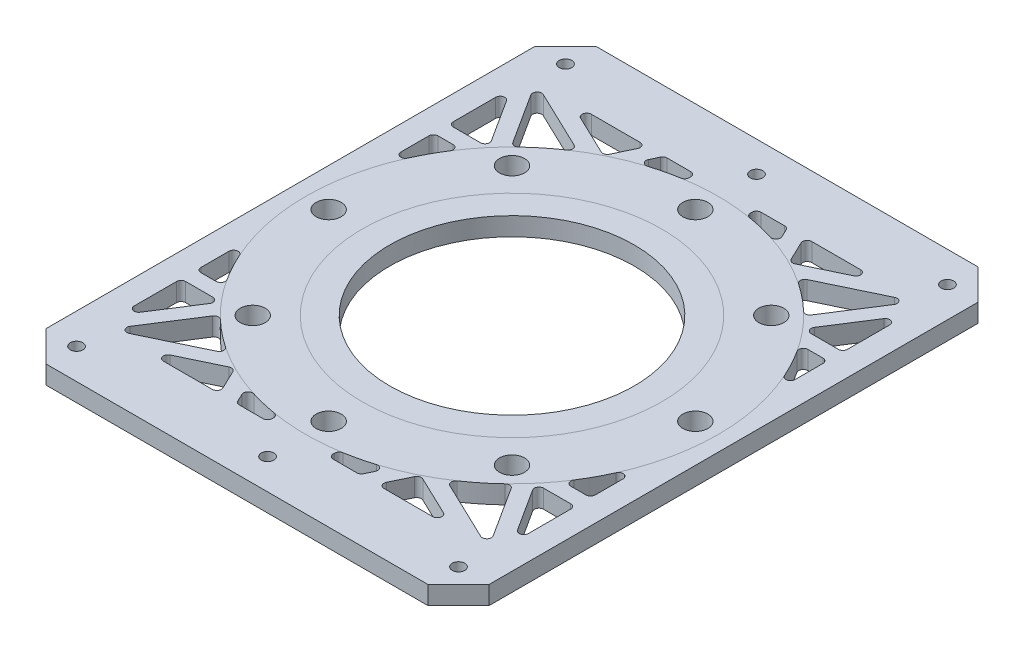
from build123d import *

# Parameters (mm, degrees)
SKETCH_1_W          = 145
SKETCH_1_H          = 180
SKETCH_1_R          = 2.05
EXTRUDE_1_DEPTH     = 6
SKETCH_2_R          = 4.1
CUT_EXTRUDE_1_DEPTH = 6
SKETCH_3_R          = 40
CUT_EXTRUDE_2_DEPTH = 10
FILLET_1_R          = 1.5
CHAMFER_1_SIZE      = 10


with BuildPart() as part:
    # 草图1 → 凸台-拉伸1 (new body)
    with BuildSketch(Plane(origin=(0, 0, 0), x_dir=(1, 0, 0), z_dir=(0, 1, 0))):
        Rectangle(SKETCH_1_W, SKETCH_1_H)
        with Locations(Location((-62.5, 80, 0), (0, 0, 270))):
            Circle(SKETCH_1_R, mode=Mode.SUBTRACT)
        with Locations(Location((0, 80, 0), (0, 0, 270))):
            Circle(SKETCH_1_R, mode=Mode.SUBTRACT)
        with Locations(Location((62.5, 80, 0), (0, 0, 90))):
            Circle(SKETCH_1_R, mode=Mode.SUBTRACT)
        with Locations(Location((62.5, -80, 0), (0, 0, 270))):
            Circle(SKETCH_1_R, mode=Mode.SUBTRACT)
        with Locations(Location((0, -80, 0), (0, 0, 90))):
            Circle(SKETCH_1_R, mode=Mode.SUBTRACT)
        with Locations(Location((-62.5, -80, 0), (0, 0, 90))):
            Circle(SKETCH_1_R, mode=Mode.SUBTRACT)
    extrude(amount=EXTRUDE_1_DEPTH)

    # 草图2 → 切除-拉伸1 (cut)
    with BuildSketch(Plane(origin=(0, 6, 0), x_dir=(1, 0, 0), z_dir=(0, 1, 0))):
        with Locations(Location((0, 60, 0), (0, 0, 270))):
            Circle(SKETCH_2_R)
        with Locations(Location((42.426406871, 42.426406871, 0), (0, 0, 270))):
            Circle(SKETCH_2_R)
        with Locations(Location((60, 0, 0), (0, 0, 270))):
            Circle(SKETCH_2_R)
        with Locations(Location((42.426406871, -42.426406871, 0), (0, 0, 270))):
            Circle(SKETCH_2_R)
        with Locations(Location((0, -60, 0), (0, 0, 270))):
            Circle(SKETCH_2_R)
        with Locations(Location((-42.426406871, -42.426406871, 0), (0, 0, 270))):
            Circle(SKETCH_2_R)
        with Locations(Location((-60, 0, 0), (0, 0, 270))):
            Circle(SKETCH_2_R)
        with Locations(Location((-42.426406871, 42.426406871, 0), (0, 0, 270))):
            Circle(SKETCH_2_R)
    extrude(amount=-CUT_EXTRUDE_1_DEPTH, mode=Mode.SUBTRACT)

    # 草图3 → 切除-拉伸2 (cut)
    with BuildSketch(Plane(origin=(0, 6, 0), x_dir=(1, 0, 0), z_dir=(0, 1, 0))):
        with BuildLine():
            ThreePointArc((-64.5, 19.899748742), (-60.612923678, 29.703930433), (-55.246109243, 38.782952615))
            Line((-55.246109243, 38.782952615), (-64.5, 38.782952615))
            Line((-64.5, 38.782952615), (-64.5, 19.899748742))
        make_face()
        Polygon((-51.374147782, 43.782952615), (-64.5, 64.257396399), (-64.5, 43.782952615), align=None)
        with BuildLine():
            Line((-35.70065504, 57.286239444), (-62.242241097, 70))
            Line((-62.242241097, 70), (-47.872974973, 47.586009155))
            ThreePointArc((-47.872974973, 47.586009155), (-42.067345118, 52.788147104), (-35.70065504, 57.286239444))
        make_face()
        Polygon((-30.375213045, 60.279320106), (-25.718882547, 70), (-50.668363981, 70), align=None)
        with BuildLine():
            Line((-10, 66.755149614), (-10, 70))
            Line((-10, 70), (-20.174846783, 70))
            Line((-20.174846783, 70), (-23.372570135, 63.324347334))
            ThreePointArc((-23.372570135, 63.324347334), (-16.774227566, 65.382530462), (-10, 66.755149614))
        make_face()
        with BuildLine():
            Line((10, 70), (10, 66.755149614))
            ThreePointArc((10, 66.755149614), (16.774227566, 65.382530462), (23.372570135, 63.324347334))
            Line((23.372570135, 63.324347334), (20.174846783, 70))
            Line((20.174846783, 70), (10, 70))
        make_face()
        Polygon((25.718882547, 70), (30.375213045, 60.279320106), (50.668363981, 70), align=None)
        with BuildLine():
            Line((62.242241097, 70), (35.70065504, 57.286239444))
            ThreePointArc((35.70065504, 57.286239444), (42.067345118, 52.788147104), (47.872974973, 47.586009155))
            Line((47.872974973, 47.586009155), (62.242241097, 70))
        make_face()
        Polygon((64.5, 64.257396399), (51.374147782, 43.782952615), (64.5, 43.782952615), align=None)
        with BuildLine():
            Line((64.5, 38.782952615), (55.246109243, 38.782952615))
            ThreePointArc((55.246109243, 38.782952615), (60.612923678, 29.703930433), (64.5, 19.899748742))
            Line((64.5, 19.899748742), (64.5, 38.782952615))
        make_face()
        with BuildLine():
            Line((64.5, -38.782952615), (64.5, -19.899748742))
            ThreePointArc((64.5, -19.899748742), (60.612923678, -29.703930433), (55.246109243, -38.782952615))
            Line((55.246109243, -38.782952615), (64.5, -38.782952615))
        make_face()
        Polygon((64.5, -64.257396399), (64.5, -43.782952615), (51.374147782, -43.782952615), align=None)
        with BuildLine():
            Line((62.242241097, -70), (47.872974973, -47.586009155))
            ThreePointArc((47.872974973, -47.586009155), (42.067345118, -52.788147104), (35.70065504, -57.286239444))
            Line((35.70065504, -57.286239444), (62.242241097, -70))
        make_face()
        Polygon((25.718882547, -70), (50.668363981, -70), (30.375213045, -60.279320106), align=None)
        with BuildLine():
            ThreePointArc((23.372570135, -63.324347334), (16.774227566, -65.382530462), (10, -66.755149614))
            Line((10, -66.755149614), (10, -70))
            Line((10, -70), (20.174846783, -70))
            Line((20.174846783, -70), (23.372570135, -63.324347334))
        make_face()
        with BuildLine():
            ThreePointArc((-10, -66.755149614), (-16.774227566, -65.382530462), (-23.372570135, -63.324347334))
            Line((-23.372570135, -63.324347334), (-20.174846783, -70))
            Line((-20.174846783, -70), (-10, -70))
            Line((-10, -70), (-10, -66.755149614))
        make_face()
        Polygon((-30.375213045, -60.279320106), (-50.668363981, -70), (-25.718882547, -70), align=None)
        with BuildLine():
            ThreePointArc((-35.70065504, -57.286239444), (-42.067345118, -52.788147104), (-47.872974973, -47.586009155))
            Line((-47.872974973, -47.586009155), (-62.242241097, -70))
            Line((-62.242241097, -70), (-35.70065504, -57.286239444))
        make_face()
        Polygon((-51.374147782, -43.782952615), (-64.5, -43.782952615), (-64.5, -64.257396399), align=None)
        with BuildLine():
            ThreePointArc((-55.246109243, -38.782952615), (-60.612923678, -29.703930433), (-64.5, -19.899748742))
            Line((-64.5, -19.899748742), (-64.5, -38.782952615))
            Line((-64.5, -38.782952615), (-55.246109243, -38.782952615))
        make_face()
        with Locations(Location((0, 0, 0), (0, 0, 270))):
            Circle(SKETCH_3_R)
    extrude(amount=-CUT_EXTRUDE_2_DEPTH, mode=Mode.SUBTRACT)

    # 圆角1
    fillet_1_edges = [part.edges().sort_by_distance(p)[0] for p in [
        (-10, 3, -66.755149614),
        (-23.372570135, 3, -63.324347334),
        (-20.174846783, 3, -70),
        (-10, 3, -70),
        (-30.375213045, 3, -60.279320106),
        (-50.668363981, 3, -70),
        (-25.718882547, 3, -70),
        (-51.374147782, 3, -43.782952615),
        (-64.5, 3, -43.782952615),
        (-64.5, 3, -64.257396399),
        (-35.70065504, 3, -57.286239444),
        (-47.872974973, 3, -47.586009155),
        (-62.242241097, 3, -70),
        (47.872974973, 3, -47.586009155),
        (35.70065504, 3, -57.286239444),
        (62.242241097, 3, -70),
        (51.374147782, 3, -43.782952615),
        (64.5, 3, -64.257396399),
        (64.5, 3, -43.782952615),
        (50.668363981, 3, -70),
        (30.375213045, 3, -60.279320106),
        (25.718882547, 3, -70),
        (23.372570135, 3, -63.324347334),
        (10, 3, -66.755149614),
        (10, 3, -70),
        (20.174846783, 3, -70),
        (-50.668363981, 3, 70),
        (-30.375213045, 3, 60.279320106),
        (-25.718882547, 3, 70),
        (-23.372570135, 3, 63.324347334),
        (-10, 3, 66.755149614),
        (-10, 3, 70),
        (-20.174846783, 3, 70),
        (10, 3, 66.755149614),
        (23.372570135, 3, 63.324347334),
        (20.174846783, 3, 70),
        (10, 3, 70),
        (30.375213045, 3, 60.279320106),
        (50.668363981, 3, 70),
        (25.718882547, 3, 70),
        (51.374147782, 3, 43.782952615),
        (64.5, 3, 43.782952615),
        (64.5, 3, 64.257396399),
        (35.70065504, 3, 57.286239444),
        (47.872974973, 3, 47.586009155),
        (62.242241097, 3, 70),
        (55.246109243, 3, 38.782952615),
        (64.5, 3, 19.899748742),
        (64.5, 3, 38.782952615),
        (64.5, 3, -19.899748742),
        (55.246109243, 3, -38.782952615),
        (64.5, 3, -38.782952615),
        (-64.5, 3, 43.782952615),
        (-51.374147782, 3, 43.782952615),
        (-64.5, 3, 64.257396399),
        (-47.872974973, 3, 47.586009155),
        (-35.70065504, 3, 57.286239444),
        (-62.242241097, 3, 70),
        (-64.5, 3, 19.899748742),
        (-55.246109243, 3, 38.782952615),
        (-64.5, 3, 38.782952615),
        (-55.246109243, 3, -38.782952615),
        (-64.5, 3, -19.899748742),
        (-64.5, 3, -38.782952615),
    ]]
    fillet(fillet_1_edges, radius=FILLET_1_R)

    # 倒角1
    chamfer_1_edges = [part.edges().sort_by_distance(p)[0] for p in [
        (-72.5, 3, -90),
        (72.5, 3, -90),
        (72.5, 3, 90),
        (-72.5, 3, 90),
    ]]
    chamfer(chamfer_1_edges, length=CHAMFER_1_SIZE)


solid = part.part
